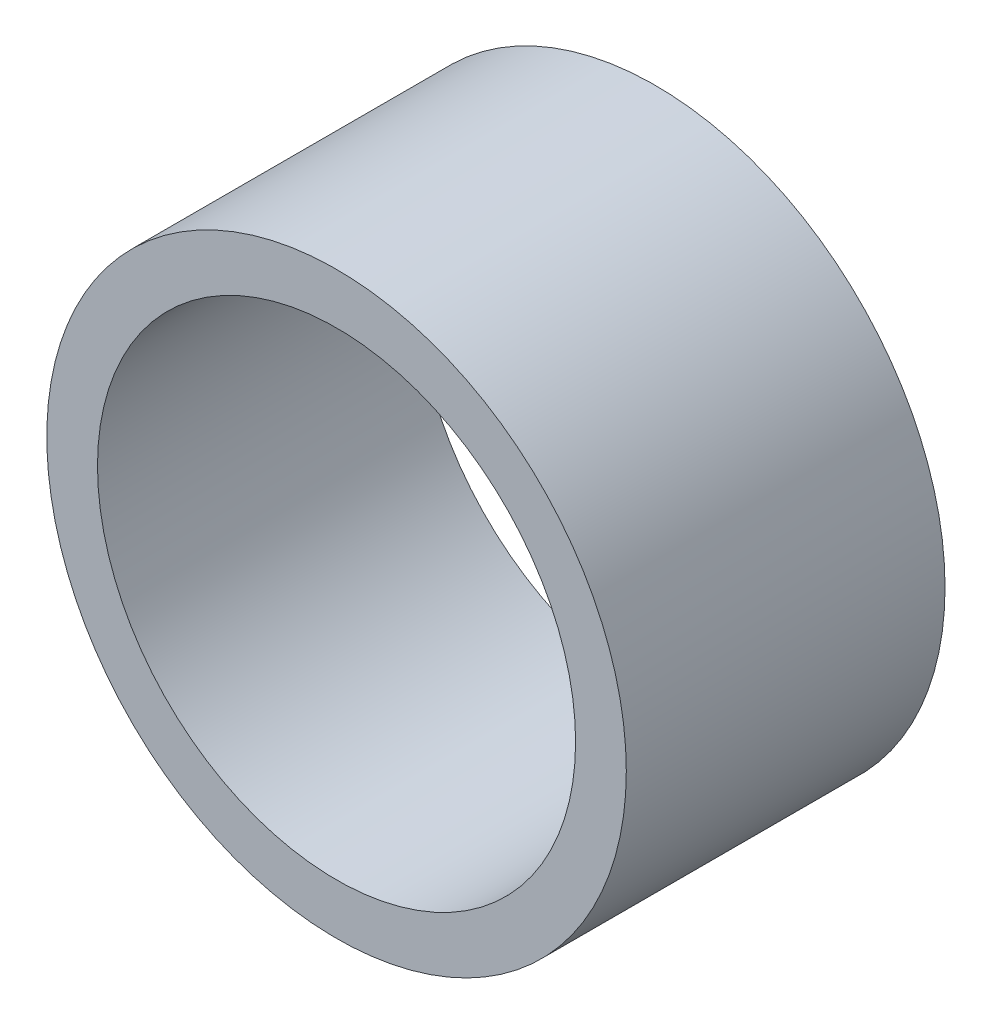
from build123d import *

# Parameters (mm, degrees)
SALIENTE_EXTRUIR1_DEPTH      = 3.75
SALIENTE_EXTRUIR1_DEPTH_BACK = 18.25
CROQUIS1_R                   = 20
CROQUIS1_R_2                 = 16.5


with BuildPart() as part:
    # Croquis1 → Saliente-Extruir1 (new, two sides: drawn at the far end of the back side and taken through both)
    with BuildSketch(Plane.XY.offset(-SALIENTE_EXTRUIR1_DEPTH_BACK)):
        with Locations((-6.34746922, -2.918376653)):
            Circle(CROQUIS1_R)
        with Locations((-6.34746922, -2.918376653)):
            Circle(CROQUIS1_R_2, mode=Mode.SUBTRACT)
    extrude(amount=SALIENTE_EXTRUIR1_DEPTH + SALIENTE_EXTRUIR1_DEPTH_BACK)


solid = part.part
